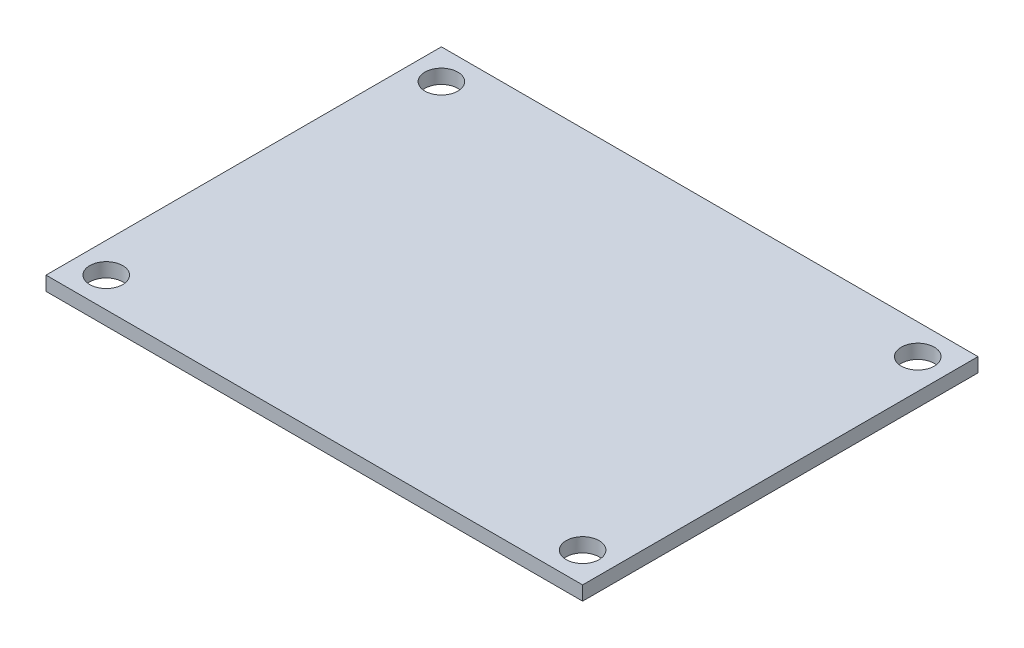
from build123d import *

# Parameters (mm, degrees)
SKETCH1_W           = 57
SKETCH1_H           = 42
BOSS_EXTRUDE1_DEPTH = 1.5
SKETCH2_R           = 1.75
CUT_EXTRUDE1_DEPTH  = 10


with BuildPart() as part:
    # Sketch1 → Boss-Extrude1 (new body)
    with BuildSketch(Plane(origin=(0, 0, 0), x_dir=(1, 0, 0), z_dir=(0, 1, 0))):
        Rectangle(SKETCH1_W, SKETCH1_H)
    extrude(amount=BOSS_EXTRUDE1_DEPTH)

    # Sketch2 → Cut-Extrude1 (cut)
    with BuildSketch(Plane(origin=(0, 1.5, 0), x_dir=(1, 0, 0), z_dir=(0, 1, 0))):
        with Locations(Location((-25.3, 17.8, 0), (0, 0, 270))):
            Circle(SKETCH2_R)
        with Locations(Location((-25.3, -17.8, 0), (0, 0, 270))):
            Circle(SKETCH2_R)
        with Locations(Location((25.3, -17.8, 0), (0, 0, 270))):
            Circle(SKETCH2_R)
        with Locations(Location((25.3, 17.8, 0), (0, 0, 270))):
            Circle(SKETCH2_R)
    extrude(amount=-CUT_EXTRUDE1_DEPTH, mode=Mode.SUBTRACT)


solid = part.part
